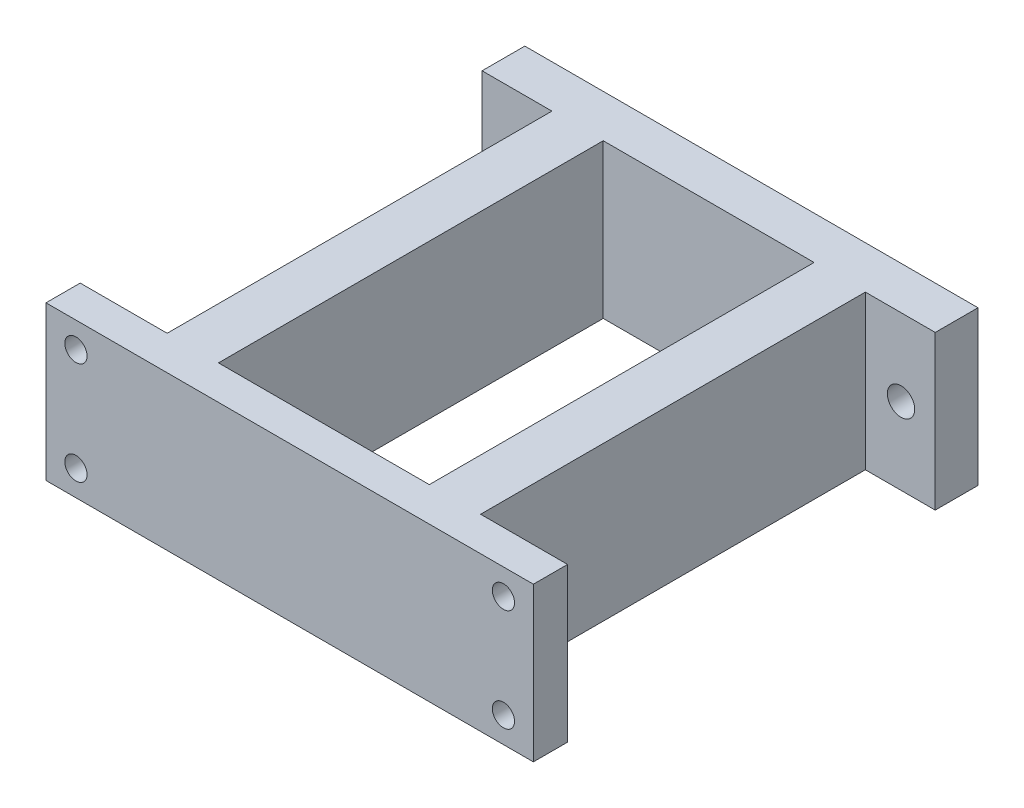
from build123d import *

# Parameters (mm, degrees)
SKETCH_1_W           = 5
SKETCH_1_H           = 18
SKETCH_1_R           = 1.3
EXTRUDE_1_DEPTH      = 4
SKETCH_2_W           = 5
SKETCH_2_H           = 18
EXTRUDE_2_DEPTH      = 54
SKETCH_3_W           = 5
SKETCH_3_H           = 18
EXTRUDE_3_DEPTH      = 53
SKETCH_4_R           = 1.6
CUT_EXTRUDE_1_DEPTH  = 50
SKETCH_8_W           = 4
SKETCH_8_H           = 18
EXTRUDE_4_DEPTH      = 53
SKETCH_9_R           = 1.3
CUT_EXTRUDE_6_DEPTH  = 12
SKETCH_14_W          = 4
SKETCH_14_H          = 18
CUT_EXTRUDE_8_DEPTH  = 5
SKETCH_15_W          = 4
SKETCH_15_H          = 18
CUT_EXTRUDE_9_DEPTH  = 5
SKETCH_16_W          = 6
SKETCH_16_H          = 18
EXTRUDE_5_DEPTH      = 45
SKETCH_17_W          = 5
SKETCH_17_H          = 18
CUT_EXTRUDE_10_DEPTH = 77
SKETCH_19_W          = 4
SKETCH_19_H          = 18
EXTRUDE_6_DEPTH      = 2


with BuildPart() as part:
    # 草图1 → 凸台-拉伸1 (new body)
    with BuildSketch(Plane.XY):
        Rectangle(SKETCH_1_W, SKETCH_1_H)
        with Locations((0, -6)):
            Circle(SKETCH_1_R, mode=Mode.SUBTRACT)
        with Locations(Location((0, 6, 0), (0, 0, 180))):
            Circle(SKETCH_1_R, mode=Mode.SUBTRACT)
    extrude_1 = extrude(amount=EXTRUDE_1_DEPTH)

    # 草图2 → 凸台-拉伸2 (add)
    with BuildSketch(Plane.XY.offset(4)):
        with Locations((-5, 0)):
            Rectangle(SKETCH_2_W, SKETCH_2_H)
    extrude_2 = extrude(amount=-EXTRUDE_2_DEPTH)

    # 草图3 → 凸台-拉伸3 (add)
    with BuildSketch(Plane.ZY.offset(7.5)):
        with Locations((-47.5, 0)):
            Rectangle(SKETCH_3_W, SKETCH_3_H)
    extrude(amount=EXTRUDE_3_DEPTH)

    # 镜向1: 凸台-拉伸2 across plane
    add(extrude_2.mirror(Plane.ZY.offset(34)))

    # 镜向2: 凸台-拉伸1 across plane
    add(extrude_1.mirror(Plane.ZY.offset(34)))

    # 草图4 → 切除-拉伸1 (cut)
    with BuildSketch(Plane(origin=(0, 0, -50), x_dir=(-1, 0, 0), z_dir=(0, 0, -1))):
        with Locations((11.5, 0)):
            Circle(SKETCH_4_R)
        with Locations((56.5, 0)):
            Circle(SKETCH_4_R)
    extrude(amount=-CUT_EXTRUDE_1_DEPTH, mode=Mode.SUBTRACT)

    # 草图8 → 凸台-拉伸4 (add)
    with BuildSketch(Plane.ZY.offset(7.5)):
        with Locations((2, 0)):
            Rectangle(SKETCH_8_W, SKETCH_8_H)
    extrude(amount=EXTRUDE_4_DEPTH)

    # 草图9 → 切除-拉伸6 (cut)
    with BuildSketch(Plane(origin=(0, 0, 0), x_dir=(-1, 0, 0), z_dir=(0, 0, -1))):
        with Locations((59, 6)):
            Circle(SKETCH_9_R)
        with Locations((59, -6)):
            Circle(SKETCH_9_R)
        with Locations((9, -6)):
            Circle(SKETCH_9_R)
        with Locations((9, 6)):
            Circle(SKETCH_9_R)
    extrude(amount=-CUT_EXTRUDE_6_DEPTH, mode=Mode.SUBTRACT)

    # 草图14 → 切除-拉伸8 (cut)
    with BuildSketch(Plane(origin=(2.5, 0, 0), x_dir=(0, 0, -1), z_dir=(1, 0, 0))):
        with Locations((-2, 0)):
            Rectangle(SKETCH_14_W, SKETCH_14_H)
    extrude(amount=-CUT_EXTRUDE_8_DEPTH, mode=Mode.SUBTRACT)

    # 草图15 → 切除-拉伸9 (cut)
    with BuildSketch(Plane.ZY.offset(70.5)):
        with Locations((2, 0)):
            Rectangle(SKETCH_15_W, SKETCH_15_H)
    extrude(amount=-CUT_EXTRUDE_9_DEPTH, mode=Mode.SUBTRACT)

    # 草图16 → 凸台-拉伸5 (add)
    with BuildSketch(Plane(origin=(0, 0, 0), x_dir=(-1, 0, 0), z_dir=(0, 0, -1))):
        with Locations((18.670705093, 0)):
            Rectangle(SKETCH_16_W, SKETCH_16_H)
        with Locations((49.329294907, 0)):
            Rectangle(SKETCH_16_W, SKETCH_16_H)
    extrude_5 = extrude(amount=EXTRUDE_5_DEPTH)

    # 草图17 → 切除-拉伸10 (cut)
    with BuildSketch(Plane.XY.offset(4)):
        with Locations((-5, 0)):
            Rectangle(SKETCH_17_W, SKETCH_17_H)
    cut_extrude_10 = extrude(amount=-CUT_EXTRUDE_10_DEPTH, mode=Mode.SUBTRACT)

    # 草图19 → 凸台-拉伸6 (add)
    with BuildSketch(Plane(origin=(-7.5, 0, 0), x_dir=(0, 0, -1), z_dir=(1, 0, 0))):
        with Locations((-2, 0)):
            Rectangle(SKETCH_19_W, SKETCH_19_H)
    extrude_6 = extrude(amount=EXTRUDE_6_DEPTH)

    # 镜向3: 凸台-拉伸5, 切除-拉伸10, 凸台-拉伸6 across plane
    add(extrude_5.mirror(Plane.ZY.offset(34)))
    add(cut_extrude_10.mirror(Plane.ZY.offset(34)), mode=Mode.SUBTRACT)
    add(extrude_6.mirror(Plane.ZY.offset(34)))


solid = part.part
